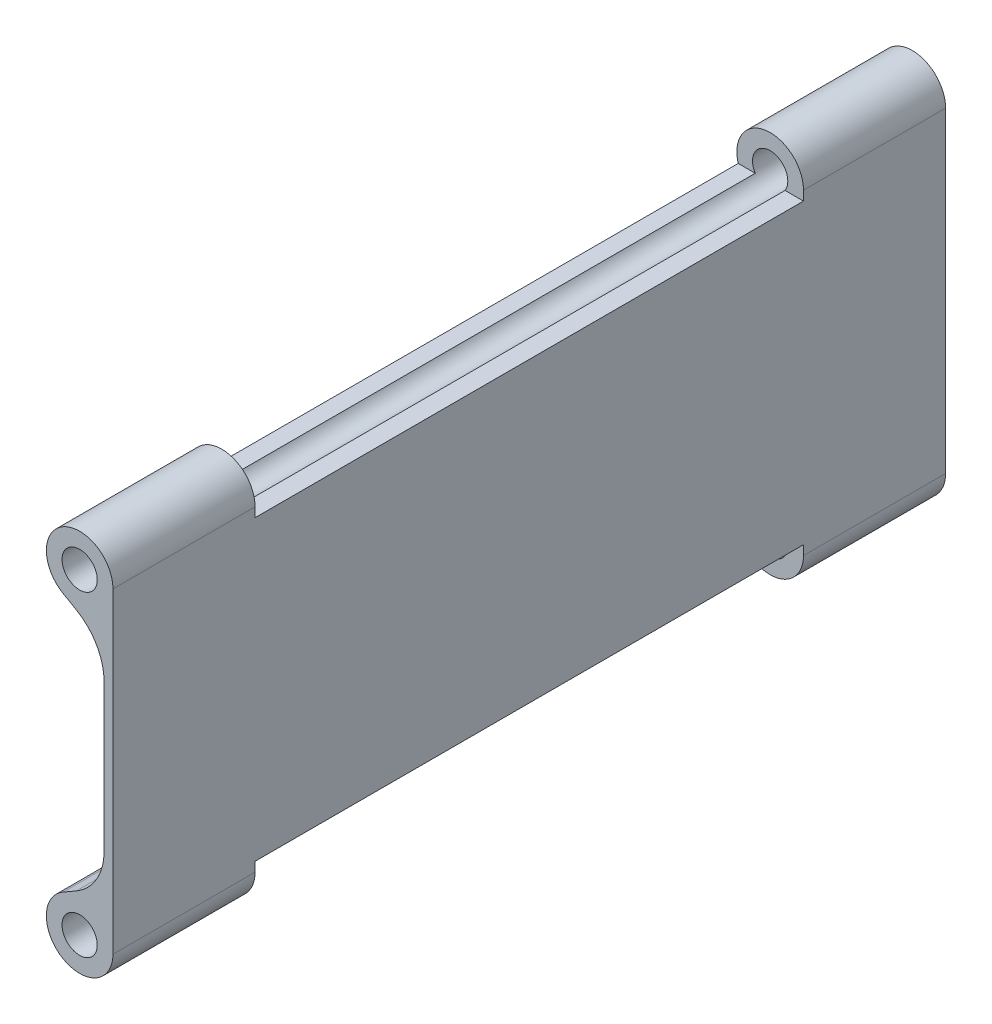
from build123d import *

# Parameters (mm, degrees)
CROQUIS1_R              = 3.175
SALIENTE_EXTRUIR1_DEPTH = 150
REDONDEO1_R             = 10
CROQUIS3_W              = 98.791812306
CROQUIS3_H              = 18.145434914
CORTAR_EXTRUIR2_DEPTH   = 155.383451186


with BuildPart() as part:
    # Croquis1 → Saliente-Extruir1 (new body)
    with BuildSketch(Plane.XY):
        with BuildLine():
            Line((-1.6, 19.056228096), (-8.98691391, 23.296314259))
            ThreePointArc((-8.98691391, 23.296314259), (-9.006535925, 33.69237342), (0, 28.5))
            Line((0, 28.5), (0, -28.5))
            ThreePointArc((0, -28.5), (-9.006535925, -33.69237342), (-8.98691391, -23.296314259))
            Line((-8.98691391, -23.296314259), (-1.6, -19.056228096))
            Line((-1.6, -19.056228096), (-1.6, 19.056228096))
        make_face()
        with Locations((-6, 28.5)):
            Circle(CROQUIS1_R, mode=Mode.SUBTRACT)
        with Locations(Location((-6, -28.5, 0), (0, 0, 180))):
            Circle(CROQUIS1_R, mode=Mode.SUBTRACT)
    extrude(amount=-SALIENTE_EXTRUIR1_DEPTH)

    # Redondeo1
    redondeo1_edges = [part.edges().sort_by_distance(p)[0] for p in [
        (-1.6, -19.056228096, -75),
        (-1.6, 19.056228096, -75),
    ]]
    fillet(redondeo1_edges, radius=REDONDEO1_R)

    # Croquis3 → Cortar-Extruir2 (cut, through all)
    with BuildSketch(Plane(origin=(0, 0, 0), x_dir=(0, 0, -1), z_dir=(1, 0, 0))):
        with Locations((75, 35.875128035)):
            Rectangle(CROQUIS3_W, CROQUIS3_H)
        with Locations((75, -35.875128035)):
            Rectangle(CROQUIS3_W, CROQUIS3_H)
    extrude(amount=-CORTAR_EXTRUIR2_DEPTH, mode=Mode.SUBTRACT)


solid = part.part
